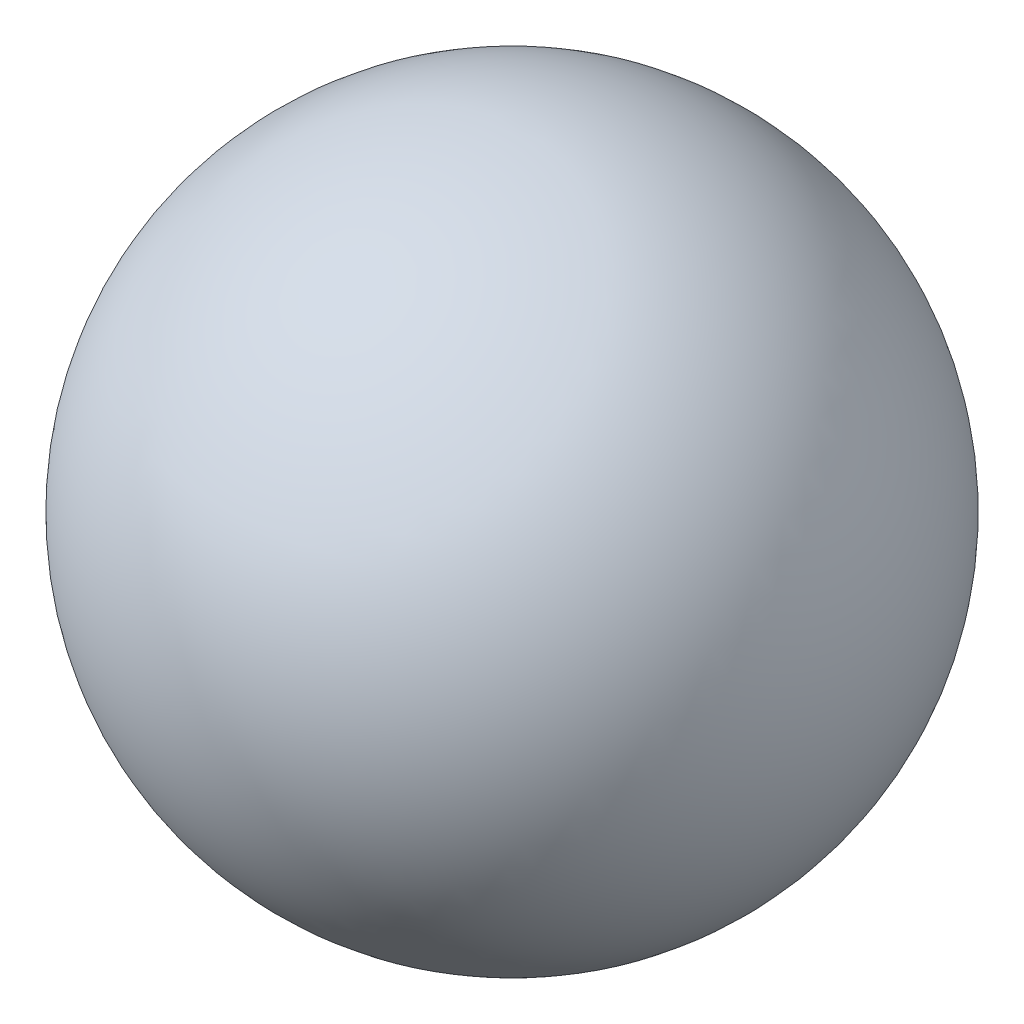
from build123d import *


with BuildPart() as part:
    # Esquisse1 → Révolution1 (revolve)
    with BuildSketch(Plane.XY):
        with BuildLine():
            Line((0, 30), (0, -30))
            ThreePointArc((0, -30), (30, 0), (0, 30))
        make_face()
    revolve(axis=Axis((0, 30, 0), (0, -1, 0)))


solid = part.part
